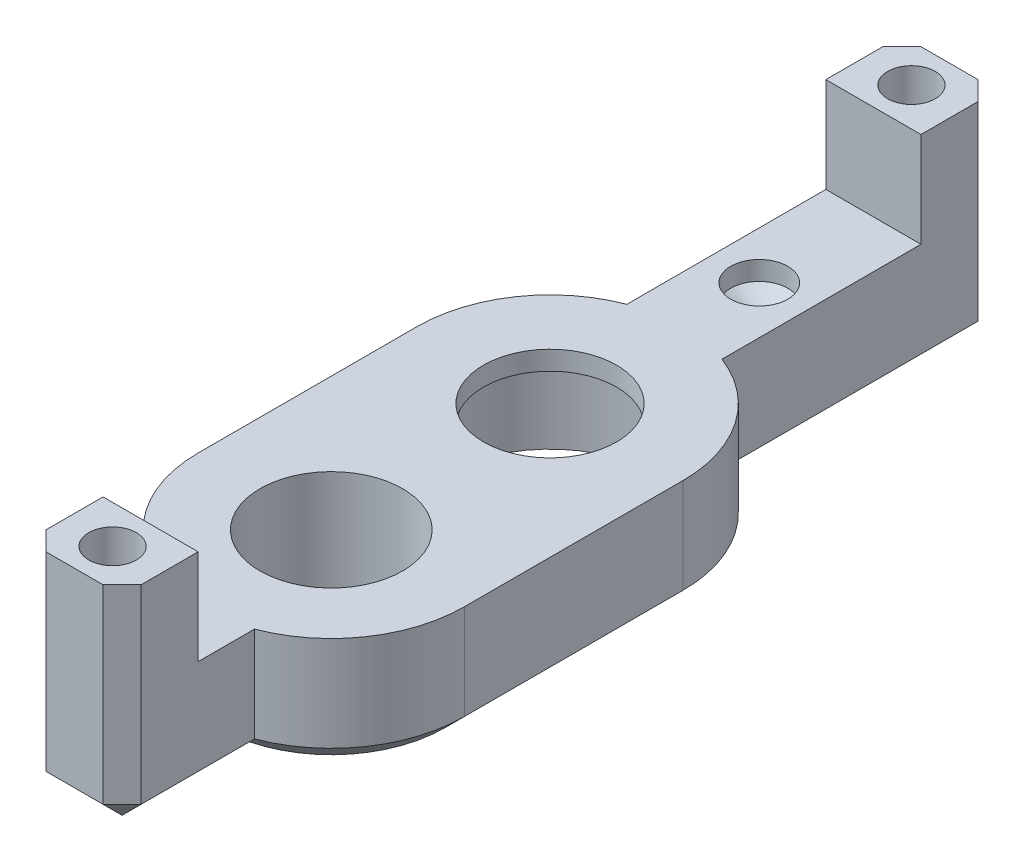
from build123d import *

# Parameters (mm, degrees)
ESBO_O2_W                                   = 14
ESBO_O2_H                                   = 46
RESSALTO_EXTRUS_O1_DEPTH                    = 6
CORTE_EXTRUS_O1_DEPTH                       = 49.456165758
FURO_DE_DI_METRO_7_5_7_5_1_D                = 7.5
CORTE_EXTRUS_O2_DEPTH                       = 49.456165758
ESBO_O10_W                                  = 5
ESBO_O10_H                                  = 4
RESSALTO_EXTRUS_O2_DEPTH                    = 5
BROCA_DE_ROSQUEAR_PARA_TARRAXA_DE_M31_D     = 2.5
BROCA_DE_ROSQUEAR_PARA_TARRAXA_DE_M31_DEPTH = 4
BROCA_DE_ROSQUEAR_PARA_TARRAXA_DE_M31_TIP   = 0.751075774
FURO_DE_DI_METRO_7_0_7_1_D                  = 7
CHANFRO1_SIZE                               = 1
FURO_DE_DI_METRO_3_0_3_1_D                  = 3
FURO_DE_DI_METRO_3_0_3_1_DEPTH              = 1
FURO_DE_DI_METRO_3_0_3_1_TIP                = 0.901290929
ESBO_O14_R                                  = 5.55
CORTE_EXTRUS_O4_DEPTH                       = 5


with BuildPart() as part:
    # Esboço2 → Ressalto-extrusão1 (new body)
    with BuildSketch(Plane(origin=(0, 0, 0), x_dir=(1, 0, 0), z_dir=(0, 1, 0))):
        with Locations((7, 23)):
            Rectangle(ESBO_O2_W, ESBO_O2_H)
    extrude(amount=RESSALTO_EXTRUS_O1_DEPTH)

    # Esboço6 → Corte-extrusão1 (cut, through all)
    with BuildSketch(Plane(origin=(0, 6, 0), x_dir=(1, 0, 0), z_dir=(0, 1, 0))):
        with BuildLine():
            Line((4.5, 46), (4.5, 31.538348415))
            ThreePointArc((4.5, 31.538348415), (1.233718703, 28.968626967), (0, 25))
            Line((0, 25), (0, 46))
            Line((0, 46), (4.5, 46))
        make_face()
        with BuildLine():
            Line((9.5, 46), (9.5, 31.538348415))
            ThreePointArc((9.5, 31.538348415), (12.766281297, 28.968626967), (14, 25))
            Line((14, 25), (14, 46))
            Line((14, 46), (9.5, 46))
        make_face()
    extrude(amount=-CORTE_EXTRUS_O1_DEPTH, mode=Mode.SUBTRACT)

    # Furo de diâmetro Ø7.5 (7.5)1 (through all)
    with Locations(Plane(origin=(7, 6, -13.5), x_dir=(0, 0, 1), z_dir=(0, 1, 0))):
        with Locations((0, 0)):
            Hole(FURO_DE_DI_METRO_7_5_7_5_1_D / 2)

    # Esboço9 → Corte-extrusão2 (cut, through all)
    with BuildSketch(Plane(origin=(0, 6, 0), x_dir=(1, 0, 0), z_dir=(0, 1, 0))):
        with BuildLine():
            Line((0, 13.5), (0, 0))
            Line((0, 0), (4.5, 0))
            Line((4.5, 0), (4.5, 6.961651585))
            ThreePointArc((4.5, 6.961651585), (1.233718703, 9.531373033), (0, 13.5))
        make_face()
        with BuildLine():
            Line((9.5, 0), (9.5, 6.961651585))
            ThreePointArc((9.5, 6.961651585), (12.766281297, 9.531373033), (14, 13.5))
            Line((14, 13.5), (14, 0))
            Line((14, 0), (9.5, 0))
        make_face()
    extrude(amount=-CORTE_EXTRUS_O2_DEPTH, mode=Mode.SUBTRACT)

    # Esboço10 → Ressalto-extrusão2 (add)
    with BuildSketch(Plane(origin=(0, 6, 0), x_dir=(1, 0, 0), z_dir=(0, 1, 0))):
        with Locations((7, 44)):
            Rectangle(ESBO_O10_W, ESBO_O10_H)
        with Locations((7, 2)):
            Rectangle(ESBO_O10_W, ESBO_O10_H)
    extrude(amount=RESSALTO_EXTRUS_O2_DEPTH)

    # Broca de rosquear para tarraxa de M31
    with Locations(Plane(origin=(7, 11, -2), x_dir=(0, 0, 1), z_dir=(0, 1, 0))):
        with Locations((0, 0), (-42, 0)):
            Hole(BROCA_DE_ROSQUEAR_PARA_TARRAXA_DE_M31_D / 2, depth=BROCA_DE_ROSQUEAR_PARA_TARRAXA_DE_M31_DEPTH)
            with Locations((0, 0, -(BROCA_DE_ROSQUEAR_PARA_TARRAXA_DE_M31_DEPTH + BROCA_DE_ROSQUEAR_PARA_TARRAXA_DE_M31_TIP / 2))):  # 118° drill point
                Cone(0, BROCA_DE_ROSQUEAR_PARA_TARRAXA_DE_M31_D / 2, BROCA_DE_ROSQUEAR_PARA_TARRAXA_DE_M31_TIP, mode=Mode.SUBTRACT)

    # Furo de diâmetro Ø7.0 (7)1 (through all)
    with Locations(Plane(origin=(7, 6, -25), x_dir=(0, 0, 1), z_dir=(0, 1, 0))):
        with Locations((0, 0)):
            Hole(FURO_DE_DI_METRO_7_0_7_1_D / 2)

    # Chanfro1
    chanfro1_edges = [part.edges().sort_by_distance(p)[0] for p in [
        (0, 0, -19.25),
        (7, 0, -46),
        (9.5, 5.5, -46),
        (12.766281297, 0, -28.968626967),
        (9.5, 0, -38.769174208),
        (4.5, 0, -38.769174208),
        (4.5, 5.5, -46),
        (1.233718703, 0, -28.968626967),
        (14, 0, -19.25),
        (7, 0, 0),
        (1.233718703, 0, -9.531373033),
        (4.5, 0, -3.480825792),
        (4.5, 5.5, 0),
        (9.5, 0, -3.480825792),
        (9.5, 5.5, 0),
        (12.766281297, 0, -9.531373033),
    ]]
    chamfer(chanfro1_edges, length=CHANFRO1_SIZE)

    # Furo de diâmetro Ø3.0 (3)1
    with Locations(Plane(origin=(7, 6, -36), x_dir=(0, 0, 1), z_dir=(0, 1, 0))):
        with Locations((0, 0)):
            Hole(FURO_DE_DI_METRO_3_0_3_1_D / 2, depth=FURO_DE_DI_METRO_3_0_3_1_DEPTH)
            with Locations((0, 0, -(FURO_DE_DI_METRO_3_0_3_1_DEPTH + FURO_DE_DI_METRO_3_0_3_1_TIP / 2))):  # 118° drill point
                Cone(0, FURO_DE_DI_METRO_3_0_3_1_D / 2, FURO_DE_DI_METRO_3_0_3_1_TIP, mode=Mode.SUBTRACT)

    # Esboço14 → Corte-extrusão4 (cut)
    with BuildSketch(Plane.XZ):
        with Locations(Location((7, -25, 0), (0, 0, 270))):
            Circle(ESBO_O14_R)
    extrude(amount=-CORTE_EXTRUS_O4_DEPTH, mode=Mode.SUBTRACT)


solid = part.part
